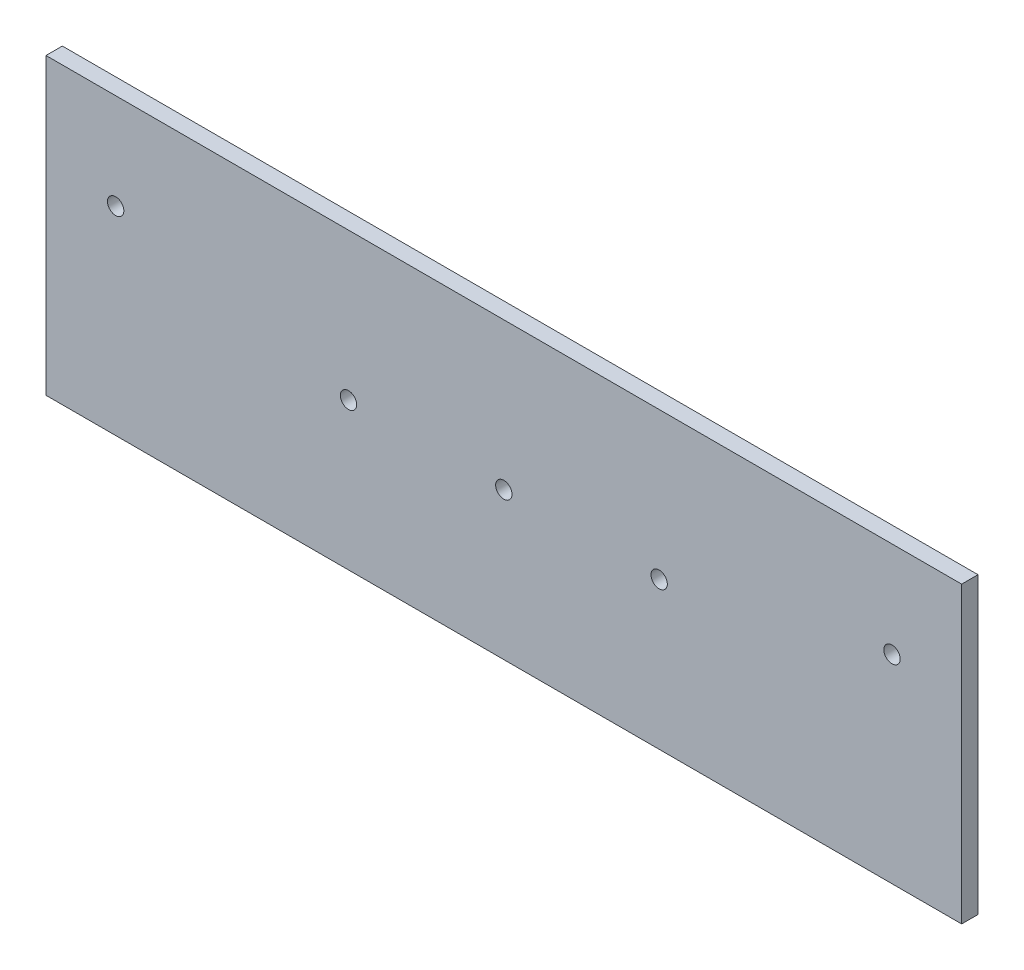
from build123d import *

# Parameters (mm, degrees)
SKETCH1_W           = 355.6
SKETCH1_H           = 114.3
BOSS_EXTRUDE1_DEPTH = 6.35
SKETCH3_R           = 3.175
CUT_EXTRUDE1_DEPTH  = 6.35


with BuildPart() as part:
    # Sketch1 → Boss-Extrude1 (new body)
    with BuildSketch(Plane.XY):
        Rectangle(SKETCH1_W, SKETCH1_H)
    extrude(amount=BOSS_EXTRUDE1_DEPTH)

    # Sketch3 → Cut-Extrude1 (cut)
    with BuildSketch(Plane.XY.offset(6.35)):
        with Locations((-60.325, 0)):
            Circle(SKETCH3_R)
        Circle(SKETCH3_R)
        with Locations((-150.749, 20)):
            Circle(SKETCH3_R)
    cut_extrude1 = extrude(amount=-CUT_EXTRUDE1_DEPTH, mode=Mode.SUBTRACT)

    # Mirror3: Cut-Extrude1 across plane
    add(cut_extrude1.mirror(Plane(origin=(0, 0, 0), x_dir=(0, 0, 1), z_dir=(1, 0, 0))), mode=Mode.SUBTRACT)


solid = part.part
